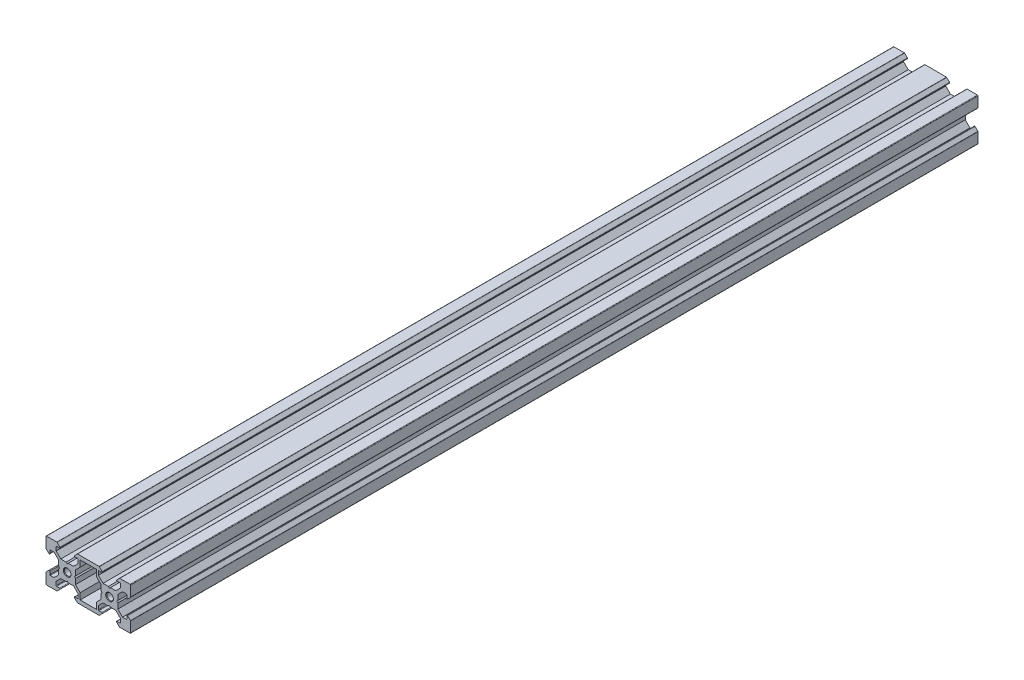
from build123d import *

# Parameters (mm, degrees)
SALIENTE_EXTRUIR1_DEPTH      = 200
SALIENTE_EXTRUIR1_DEPTH_BACK = 200
CROQUIS4_R                   = 1.569264143
CORTAR_EXTRUIR1_DEPTH        = 402.248052955
CHAFL_N1_SIZE                = 0.25
TALADRO_ROSCADO_M31_D        = 2.5


with BuildPart() as part:
    # Croquis1 → Saliente-Extruir1 (new, two sides: drawn at the far end of the back side and taken through both)
    with BuildSketch(Plane.XY.offset(-SALIENTE_EXTRUIR1_DEPTH_BACK)):
        with BuildLine():
            Line((-3.509619408, 8.626776695), (-4.809619408, 9.926776695))
            ThreePointArc((-4.809619408, 9.926776695), (-4.890725245, 9.980969883), (-4.986396103, 10))
            Line((-4.986396103, 10), (-15.096446609, 10))
            ThreePointArc((-15.096446609, 10), (-15.192117467, 9.980969883), (-15.273223305, 9.926776695))
            Line((-15.273223305, 9.926776695), (-16.573223305, 8.626776695))
            ThreePointArc((-16.573223305, 8.626776695), (-16.627416493, 8.354329142), (-16.396446609, 8.2))
            Line((-16.396446609, 8.2), (-15.039949494, 8.2))
            ThreePointArc((-15.039949494, 8.2), (-14.863172798, 8.126776695), (-14.789949494, 7.95))
            Line((-14.789949494, 7.95), (-14.789949494, 6.2))
            Line((-14.789949494, 6.2), (-16.989949494, 4))
            Line((-16.989949494, 4), (-19.5, 4))
            Line((-19.5, 4), (-20, 3.5))
            Line((-20, 3.5), (-20.5, 4))
            Line((-20.5, 4), (-23.010050506, 4))
            Line((-23.010050506, 4), (-25.210050506, 6.2))
            Line((-25.210050506, 6.2), (-25.210050506, 7.95))
            ThreePointArc((-25.210050506, 7.95), (-25.136827202, 8.126776695), (-24.960050506, 8.2))
            Line((-24.960050506, 8.2), (-23.603553391, 8.2))
            ThreePointArc((-23.603553391, 8.2), (-23.372583507, 8.354329142), (-23.426776695, 8.626776695))
            Line((-23.426776695, 8.626776695), (-24.726776695, 9.926776695))
            ThreePointArc((-24.726776695, 9.926776695), (-24.807882533, 9.980969883), (-24.903553391, 10))
            Line((-24.903553391, 10), (-29.75, 10))
            ThreePointArc((-29.75, 10), (-29.926776695, 9.926776695), (-30, 9.75))
            Line((-30, 9.75), (-30, 4.903553391))
            ThreePointArc((-30, 4.903553391), (-29.980969883, 4.807882533), (-29.926776695, 4.726776695))
            Line((-29.926776695, 4.726776695), (-28.626776695, 3.426776695))
            ThreePointArc((-28.626776695, 3.426776695), (-28.354329142, 3.372583507), (-28.2, 3.603553391))
            Line((-28.2, 3.603553391), (-28.2, 4.960050506))
            ThreePointArc((-28.2, 4.960050506), (-28.126776695, 5.136827202), (-27.95, 5.210050506))
            Line((-27.95, 5.210050506), (-26.2, 5.210050506))
            Line((-26.2, 5.210050506), (-24, 3.010050506))
            Line((-24, 3.010050506), (-24, 0.5))
            Line((-24, 0.5), (-23.5, 0))
            Line((-23.5, 0), (-24, -0.5))
            Line((-24, -0.5), (-24, -3.010050506))
            Line((-24, -3.010050506), (-26.2, -5.210050506))
            Line((-26.2, -5.210050506), (-27.95, -5.210050506))
            ThreePointArc((-27.95, -5.210050506), (-28.126776695, -5.136827202), (-28.2, -4.960050506))
            Line((-28.2, -4.960050506), (-28.2, -3.603553391))
            ThreePointArc((-28.2, -3.603553391), (-28.354329142, -3.372583507), (-28.626776695, -3.426776695))
            Line((-28.626776695, -3.426776695), (-29.926776695, -4.726776695))
            ThreePointArc((-29.926776695, -4.726776695), (-29.980969883, -4.807882533), (-30, -4.903553391))
            Line((-30, -4.903553391), (-30, -9.75))
            ThreePointArc((-30, -9.75), (-29.926776695, -9.926776695), (-29.75, -10))
            Line((-29.75, -10), (-24.903553391, -10))
            ThreePointArc((-24.903553391, -10), (-24.807882533, -9.980969883), (-24.726776695, -9.926776695))
            Line((-24.726776695, -9.926776695), (-23.426776695, -8.626776695))
            ThreePointArc((-23.426776695, -8.626776695), (-23.372583507, -8.354329142), (-23.603553391, -8.2))
            Line((-23.603553391, -8.2), (-24.960050506, -8.2))
            ThreePointArc((-24.960050506, -8.2), (-25.136827202, -8.126776695), (-25.210050506, -7.95))
            Line((-25.210050506, -7.95), (-25.210050506, -6.2))
            Line((-25.210050506, -6.2), (-23.010050506, -4))
            Line((-23.010050506, -4), (-20.5, -4))
            Line((-20.5, -4), (-20, -3.5))
            Line((-20, -3.5), (-19.5, -4))
            Line((-19.5, -4), (-16.989949494, -4))
            Line((-16.989949494, -4), (-14.789949494, -6.2))
            Line((-14.789949494, -6.2), (-14.789949494, -7.95))
            ThreePointArc((-14.789949494, -7.95), (-14.863172798, -8.126776695), (-15.039949494, -8.2))
            Line((-15.039949494, -8.2), (-16.396446609, -8.2))
            ThreePointArc((-16.396446609, -8.2), (-16.627416493, -8.354329142), (-16.573223305, -8.626776695))
            Line((-16.573223305, -8.626776695), (-15.273223305, -9.926776695))
            ThreePointArc((-15.273223305, -9.926776695), (-15.192117467, -9.980969883), (-15.096446609, -10))
            Line((-15.096446609, -10), (-4.986396103, -10))
            ThreePointArc((-4.986396103, -10), (-4.890725245, -9.980969883), (-4.809619408, -9.926776695))
            Line((-4.809619408, -9.926776695), (-3.509619408, -8.626776695))
            ThreePointArc((-3.509619408, -8.626776695), (-3.45542622, -8.354329142), (-3.686396103, -8.2))
            Line((-3.686396103, -8.2), (-5.042893219, -8.2))
            ThreePointArc((-5.042893219, -8.2), (-5.219669914, -8.126776695), (-5.292893219, -7.95))
            Line((-5.292893219, -7.95), (-5.292893219, -6.2))
            Line((-5.292893219, -6.2), (-3.092893219, -4))
            Line((-3.092893219, -4), (-0.582842712, -4))
            Line((-0.582842712, -4), (-0.082842712, -3.5))
            Line((-0.082842712, -3.5), (0.417157288, -4))
            Line((0.417157288, -4), (2.927207794, -4))
            Line((2.927207794, -4), (5.127207794, -6.2))
            Line((5.127207794, -6.2), (5.127207794, -7.95))
            ThreePointArc((5.127207794, -7.95), (5.053984489, -8.126776695), (4.877207794, -8.2))
            Line((4.877207794, -8.2), (3.520710678, -8.2))
            ThreePointArc((3.520710678, -8.2), (3.289740795, -8.354329142), (3.343933983, -8.626776695))
            Line((3.343933983, -8.626776695), (4.643933983, -9.926776695))
            ThreePointArc((4.643933983, -9.926776695), (4.72503982, -9.980969883), (4.820710678, -10))
            Line((4.820710678, -10), (9.667157288, -10))
            ThreePointArc((9.667157288, -10), (9.843933983, -9.926776695), (9.917157288, -9.75))
            Line((9.917157288, -9.75), (9.917157288, -4.903553391))
            ThreePointArc((9.917157288, -4.903553391), (9.898127171, -4.807882533), (9.843933983, -4.726776695))
            Line((9.843933983, -4.726776695), (8.543933983, -3.426776695))
            ThreePointArc((8.543933983, -3.426776695), (8.271486429, -3.372583507), (8.117157288, -3.603553391))
            Line((8.117157288, -3.603553391), (8.117157288, -4.960050506))
            ThreePointArc((8.117157288, -4.960050506), (8.043933983, -5.136827202), (7.867157288, -5.210050506))
            Line((7.867157288, -5.210050506), (6.117157288, -5.210050506))
            Line((6.117157288, -5.210050506), (3.917157288, -3.010050506))
            Line((3.917157288, -3.010050506), (3.917157288, -0.5))
            Line((3.917157288, -0.5), (3.417157288, 0))
            Line((3.417157288, 0), (3.917157288, 0.5))
            Line((3.917157288, 0.5), (3.917157288, 3.010050506))
            Line((3.917157288, 3.010050506), (6.117157288, 5.210050506))
            Line((6.117157288, 5.210050506), (7.867157288, 5.210050506))
            ThreePointArc((7.867157288, 5.210050506), (8.043933983, 5.136827202), (8.117157288, 4.960050506))
            Line((8.117157288, 4.960050506), (8.117157288, 3.603553391))
            ThreePointArc((8.117157288, 3.603553391), (8.271486429, 3.372583507), (8.543933983, 3.426776695))
            Line((8.543933983, 3.426776695), (9.843933983, 4.726776695))
            ThreePointArc((9.843933983, 4.726776695), (9.898127171, 4.807882533), (9.917157288, 4.903553391))
            Line((9.917157288, 4.903553391), (9.917157288, 9.75))
            ThreePointArc((9.917157288, 9.75), (9.843933983, 9.926776695), (9.667157288, 10))
            Line((9.667157288, 10), (4.820710678, 10))
            ThreePointArc((4.820710678, 10), (4.72503982, 9.980969883), (4.643933983, 9.926776695))
            Line((4.643933983, 9.926776695), (3.343933983, 8.626776695))
            ThreePointArc((3.343933983, 8.626776695), (3.289740795, 8.354329142), (3.520710678, 8.2))
            Line((3.520710678, 8.2), (4.877207794, 8.2))
            ThreePointArc((4.877207794, 8.2), (5.053984489, 8.126776695), (5.127207794, 7.95))
            Line((5.127207794, 7.95), (5.127207794, 6.2))
            Line((5.127207794, 6.2), (2.927207794, 4))
            Line((2.927207794, 4), (0.417157288, 4))
            Line((0.417157288, 4), (-0.082842712, 3.5))
            Line((-0.082842712, 3.5), (-0.582842712, 4))
            Line((-0.582842712, 4), (-3.092893219, 4))
            Line((-3.092893219, 4), (-5.292893219, 6.2))
            Line((-5.292893219, 6.2), (-5.292893219, 7.95))
            ThreePointArc((-5.292893219, 7.95), (-5.219669914, 8.126776695), (-5.042893219, 8.2))
            Line((-5.042893219, 8.2), (-3.686396103, 8.2))
            ThreePointArc((-3.686396103, 8.2), (-3.45542622, 8.354329142), (-3.509619408, 8.626776695))
        make_face()
        Polygon((-13.882842712, 5.210050506), (-13.882842712, 8.2), (-6.2, 8.2), (-6.2, 5.210050506), (-4, 3.010050506), (-4, 0.5), (-3.5, 0), (-4, -0.5), (-4, -3.010050506), (-6.2, -5.210050506), (-6.2, -8.2), (-13.882842712, -8.2), (-13.882842712, -5.210050506), (-16.082842712, -3.010050506), (-16.082842712, -0.5), (-16.582842712, 0), (-16.082842712, 0.5), (-16.082842712, 3.010050506), align=None, mode=Mode.SUBTRACT)
    extrude(amount=SALIENTE_EXTRUIR1_DEPTH + SALIENTE_EXTRUIR1_DEPTH_BACK)

    # Croquis4 → Cortar-Extruir1 (cut, through all)
    with BuildSketch(Plane.XY.offset(200)):
        with Locations((-20, 0)):
            Circle(CROQUIS4_R)
        Circle(CROQUIS4_R)
    extrude(amount=-CORTAR_EXTRUIR1_DEPTH, mode=Mode.SUBTRACT)

    # Chaflán1
    chafl_n1_edges = [part.edges().sort_by_distance(p)[0] for p in [
        (-21.569264143, 0, -200),
        (-1.569264143, 0, -200),
        (-1.569264143, 0, 200),
        (-21.569264143, 0, 200),
    ]]
    chamfer(chafl_n1_edges, length=CHAFL_N1_SIZE)

    # Taladro roscado M31 (through all)
    with Locations(Plane(origin=(0, 10, 0), x_dir=(1, 0, 0), z_dir=(0, 1, 0))):
        with Locations((-20, 160.25), (-0.082842712, 160.25)):
            Hole(TALADRO_ROSCADO_M31_D / 2)


solid = part.part
